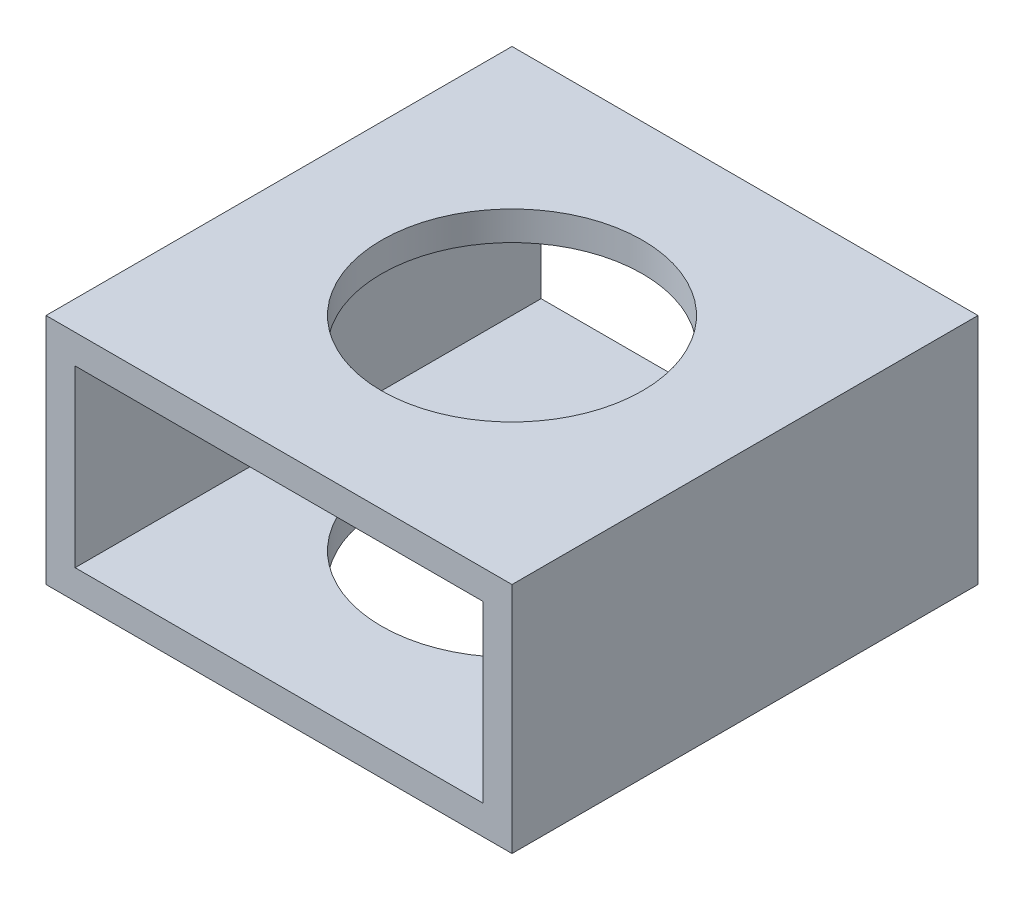
from build123d import *

# Parameters (mm, degrees)
SKETCH1_W           = 50.8
SKETCH1_H           = 25.4
SKETCH1_W_2         = 44.45
SKETCH1_H_2         = 19.05
BOSS_EXTRUDE1_DEPTH = 50.8
SKETCH2_R           = 14.224
CUT_EXTRUDE1_DEPTH  = 77.2


with BuildPart() as part:
    # Sketch1 → Boss-Extrude1 (new body)
    with BuildSketch(Plane.XY):
        with Locations((25.4, 12.7)):
            Rectangle(SKETCH1_W, SKETCH1_H)
        with Locations((25.4, 12.7)):
            Rectangle(SKETCH1_W_2, SKETCH1_H_2, mode=Mode.SUBTRACT)
    extrude(amount=BOSS_EXTRUDE1_DEPTH)

    # Sketch2 → Cut-Extrude1 (cut, through all)
    with BuildSketch(Plane(origin=(0, 25.4, 0), x_dir=(1, 0, 0), z_dir=(0, 1, 0))):
        with Locations(Location((25.4, -25.4, 0), (0, 0, 270))):
            Circle(SKETCH2_R)
    extrude(amount=-CUT_EXTRUDE1_DEPTH, mode=Mode.SUBTRACT)


solid = part.part
